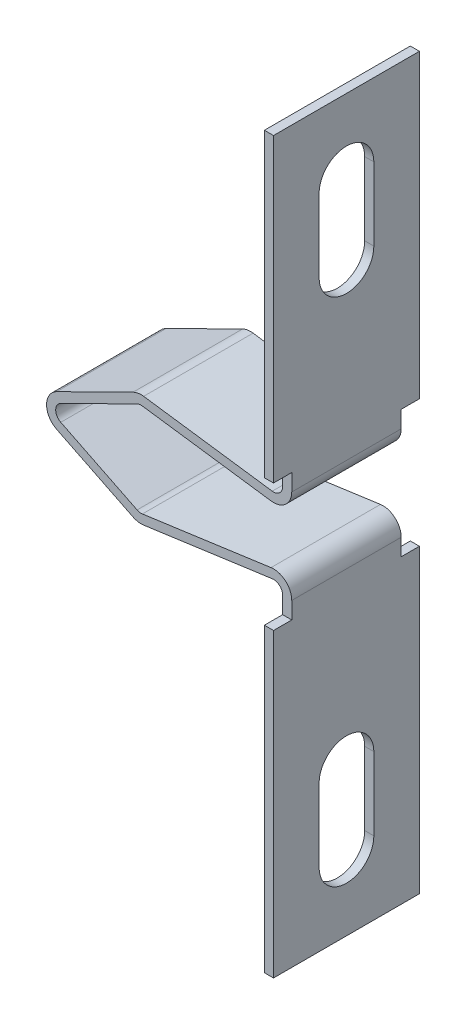
from build123d import *

# Parameters (mm, degrees)
EXTRUDE_1_DEPTH     = 4
FILLET_1_R          = 0.5
FILLET_2_R          = 1
CUT_EXTRUDE_1_DEPTH = 0.5
SKETCH_3_W          = 3.444181234
SKETCH_3_H          = 7
SKETCH_3_W_2        = 2.596632025
CUT_EXTRUDE_2_DEPTH = 17


with BuildPart() as part:
    # 草图1 → 凸台-拉伸1 (new, symmetric)
    with BuildSketch(Plane.XY):
        Polygon((0, 0), (6.275985866, 3.1), (14.2, 2), (14.2, 20), (14.7, 20), (14.7, 1.425796077), (6.359548127, 2.583605352), (1.1290092, 0), (6.359548127, -2.583605352), (14.7, -1.425796077), (14.7, -20), (14.2, -20), (14.2, -2), (6.275985866, -3.1), align=None)
    extrude(amount=EXTRUDE_1_DEPTH, both=True)

    # 圆角1
    fillet_1_edges = [part.edges().sort_by_distance(p)[0] for p in [
        (14.2, 2, 0),
        (6.359548127, 2.583605352, 0),
        (1.1290092, 0, 0),
        (6.359548127, -2.583605352, 0),
        (14.2, -2, 0),
    ]]
    fillet(fillet_1_edges, radius=FILLET_1_R)

    # 圆角2
    fillet_2_edges = [part.edges().sort_by_distance(p)[0] for p in [
        (0, 0, 0),
        (6.275985866, 3.1, 0),
        (14.7, 1.425796077, 0),
        (14.7, -1.425796077, 0),
        (6.275985866, -3.1, 0),
    ]]
    fillet(fillet_2_edges, radius=FILLET_2_R)

    # 草图2 → 切除-拉伸1 (cut)
    with BuildSketch(Plane.ZY.offset(-14.2)):
        with BuildLine():
            Line((1.5, 16), (1.5, 12))
            ThreePointArc((1.5, 12), (0, 10.5), (-1.5, 12))
            Line((-1.5, 12), (-1.5, 16))
            ThreePointArc((-1.5, 16), (0, 17.5), (1.5, 16))
        make_face()
        with BuildLine():
            Line((1.5, -12), (1.5, -16))
            ThreePointArc((1.5, -16), (0, -17.5), (-1.5, -16))
            Line((-1.5, -16), (-1.5, -12))
            ThreePointArc((-1.5, -12), (0, -10.5), (1.5, -12))
        make_face()
    extrude(amount=-CUT_EXTRUDE_1_DEPTH, mode=Mode.SUBTRACT)

    # 草图3 → 切除-拉伸2 (cut, symmetric)
    with BuildSketch(Plane.ZY.offset(-14.2)):
        with Locations((4.722090617, 0)):
            Rectangle(SKETCH_3_W, SKETCH_3_H)
        with Locations((-4.298316013, 0)):
            Rectangle(SKETCH_3_W_2, SKETCH_3_H)
    extrude(amount=CUT_EXTRUDE_2_DEPTH, both=True, mode=Mode.SUBTRACT)


solid = part.part
